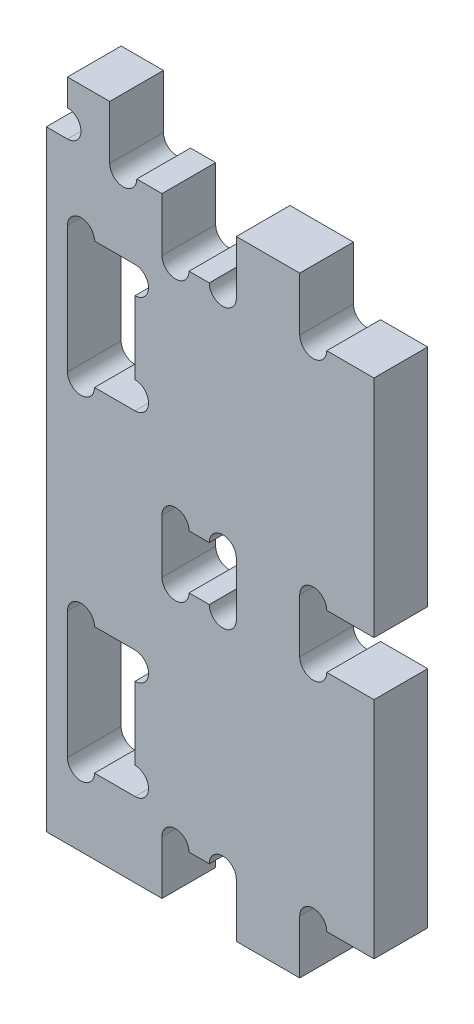
from build123d import *

# Parameters (mm, degrees)
SKETCH1_W           = 17.58
SKETCH1_H           = 12.7
SKETCH1_W_2         = 15.98
SKETCH1_H_2         = 30
BOSS_EXTRUDE1_DEPTH = 12.7
SKETCH2_R           = 3.2
CUT_EXTRUDE1_DEPTH  = 174.491786837


with BuildPart() as part:
    # Sketch1 → Boss-Extrude1 (new body)
    with BuildSketch(Plane.XY):
        Polygon((54.94, 144.4), (54.94, 131.7), (72.51, 131.7), (72.51, 78.5), (54.94, 78.5), (54.94, 65.8), (72.51, 65.8), (72.51, 12.7), (54.94, 12.7), (54.94, 0), (39.94, 0), (39.94, 12.7), (22.36, 12.7), (22.36, 0), (-5, 0), (-5, 144.4), (0, 144.4), (0, 157.1), (10, 157.1), (10, 144.4), (22.36, 144.4), (22.36, 131.7), (39.94, 131.7), (39.94, 144.4), align=None)
        with Locations((31.15, 72.15)):
            Rectangle(SKETCH1_W, SKETCH1_H, mode=Mode.SUBTRACT)
        with Locations((7.99, 111.7)):
            Rectangle(SKETCH1_W_2, SKETCH1_H_2, mode=Mode.SUBTRACT)
        with Locations((7.99, 32.7)):
            Rectangle(SKETCH1_W_2, SKETCH1_H_2, mode=Mode.SUBTRACT)
    extrude(amount=BOSS_EXTRUDE1_DEPTH)

    # Sketch2 → Cut-Extrude1 (cut, through all)
    with BuildSketch(Plane.XY.offset(12.7)):
        with Locations((58.14, 131.7)):
            Circle(SKETCH2_R)
        with Locations((58.14, 78.5)):
            Circle(SKETCH2_R)
        with Locations((58.14, 65.8)):
            Circle(SKETCH2_R)
        with Locations((36.74, 78.5)):
            Circle(SKETCH2_R)
        with Locations((36.74, 65.8)):
            Circle(SKETCH2_R)
        with Locations((25.56, 78.5)):
            Circle(SKETCH2_R)
        with Locations((25.56, 65.8)):
            Circle(SKETCH2_R)
        with Locations((25.56, 12.7)):
            Circle(SKETCH2_R)
        with Locations((36.74, 12.7)):
            Circle(SKETCH2_R)
        with Locations((58.14, 12.7)):
            Circle(SKETCH2_R)
        with Locations((36.74, 131.7)):
            Circle(SKETCH2_R)
        with Locations((25.56, 131.7)):
            Circle(SKETCH2_R)
        with Locations((13.2, 144.4)):
            Circle(SKETCH2_R)
        with Locations((15.98, 123.5)):
            Circle(SKETCH2_R)
        with Locations((3.2, 126.7)):
            Circle(SKETCH2_R)
        with Locations((3.2, 96.7)):
            Circle(SKETCH2_R)
        with Locations((15.98, 99.9)):
            Circle(SKETCH2_R)
        with Locations((15.98, 44.5)):
            Circle(SKETCH2_R)
        with Locations((15.98, 20.9)):
            Circle(SKETCH2_R)
        with Locations((3.2, 17.7)):
            Circle(SKETCH2_R)
        with Locations((3.2, 47.7)):
            Circle(SKETCH2_R)
        with Locations((0, 147.6)):
            Circle(SKETCH2_R)
    extrude(amount=-CUT_EXTRUDE1_DEPTH, mode=Mode.SUBTRACT)


solid = part.part
